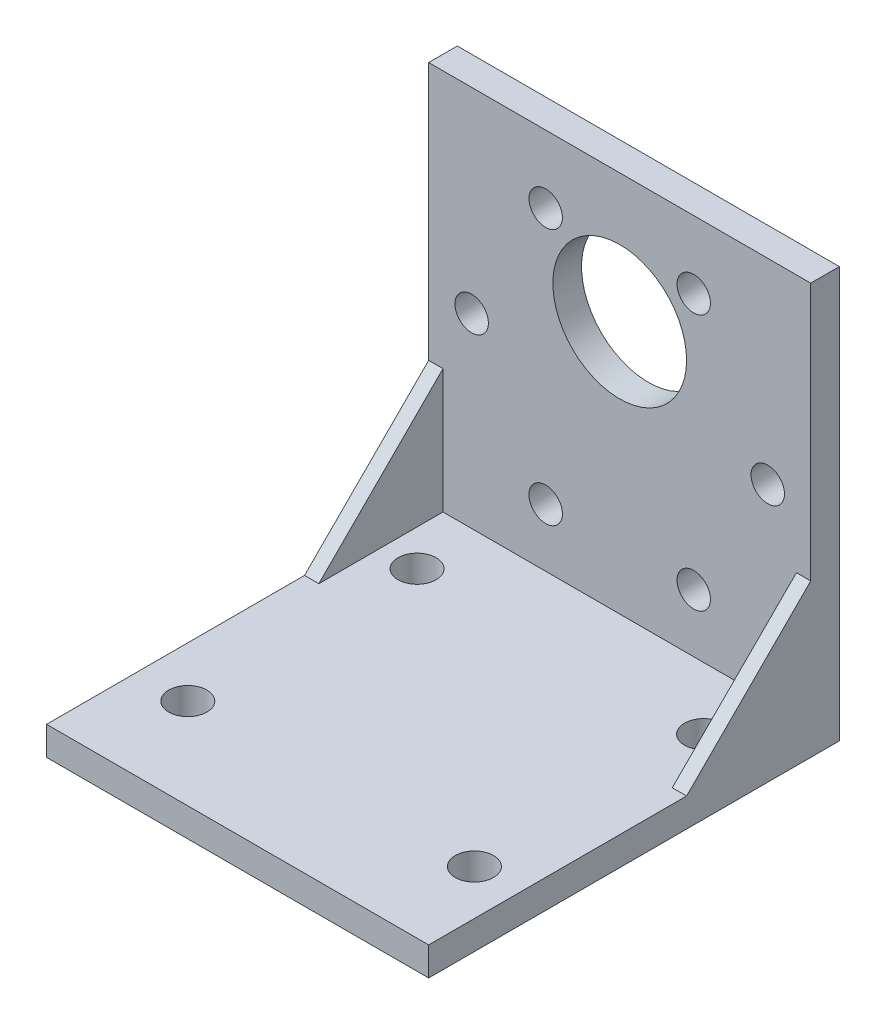
from build123d import *

# Parameters (mm, degrees)
SKETCH1_W           = 40
SKETCH1_H           = 43
SKETCH1_R           = 2
BOSS_EXTRUDE1_DEPTH = 3
SKETCH4_W           = 40
SKETCH4_H           = 3
BOSS_EXTRUDE2_DEPTH = 40
SKETCH5_R           = 7
CUT_EXTRUDE5_DEPTH  = 34
SKETCH8_R           = 1.75
CUT_EXTRUDE6_DEPTH  = 10
BOSS_EXTRUDE3_DEPTH = 1.5
BOSS_EXTRUDE4_DEPTH = 1.5


with BuildPart() as part:
    # Sketch1 → Boss-Extrude1 (new body)
    with BuildSketch(Plane(origin=(0, 0, 0), x_dir=(1, 0, 0), z_dir=(0, 1, 0))):
        Rectangle(SKETCH1_W, SKETCH1_H)
        with Locations(Location((-14.715053003, 12, 0), (0, 0, 270))):
            Circle(SKETCH1_R, mode=Mode.SUBTRACT)
        with Locations(Location((15.284946997, 12, 0), (0, 0, 270))):
            Circle(SKETCH1_R, mode=Mode.SUBTRACT)
        with Locations(Location((-14.715053003, -12, 0), (0, 0, 270))):
            Circle(SKETCH1_R, mode=Mode.SUBTRACT)
        with Locations(Location((15.284946997, -12, 0), (0, 0, 270))):
            Circle(SKETCH1_R, mode=Mode.SUBTRACT)
    extrude(amount=-BOSS_EXTRUDE1_DEPTH)

    # Sketch4 → Boss-Extrude2 (add)
    with BuildSketch(Plane(origin=(0, 0, 0), x_dir=(1, 0, 0), z_dir=(0, 1, 0))):
        with Locations((0, 20)):
            Rectangle(SKETCH4_W, SKETCH4_H)
    extrude(amount=BOSS_EXTRUDE2_DEPTH)

    # Sketch5 → Cut-Extrude5 (cut)
    with BuildSketch(Plane.XY.offset(-18.5)):
        with Locations((0, 26.5)):
            Circle(SKETCH5_R)
    extrude(amount=-CUT_EXTRUDE5_DEPTH, mode=Mode.SUBTRACT)

    # Sketch8 → Cut-Extrude6 (cut)
    with BuildSketch(Plane.XY.offset(-18.5)):
        with Locations((-15.5, 19.5)):
            Circle(SKETCH8_R)
        with Locations((-7.75, 32.923393759)):
            Circle(SKETCH8_R)
        with Locations((7.75, 32.923393759)):
            Circle(SKETCH8_R)
        with Locations((15.5, 19.5)):
            Circle(SKETCH8_R)
        with Locations((7.75, 6.076606241)):
            Circle(SKETCH8_R)
        with Locations((-7.75, 6.076606241)):
            Circle(SKETCH8_R)
    extrude(amount=-CUT_EXTRUDE6_DEPTH, mode=Mode.SUBTRACT)

    # Sketch9 → Boss-Extrude3 (add)
    with BuildSketch(Plane(origin=(20, 0, 0), x_dir=(0, 0, -1), z_dir=(1, 0, 0))):
        Polygon((18.5, 0), (18.5, 13), (5.5, 0), align=None)
    extrude(amount=-BOSS_EXTRUDE3_DEPTH)

    # Sketch10 → Boss-Extrude4 (add)
    with BuildSketch(Plane.ZY.offset(20)):
        Polygon((-18.5, 0), (-18.5, 13), (-5.5, 0), align=None)
    extrude(amount=-BOSS_EXTRUDE4_DEPTH)


solid = part.part
